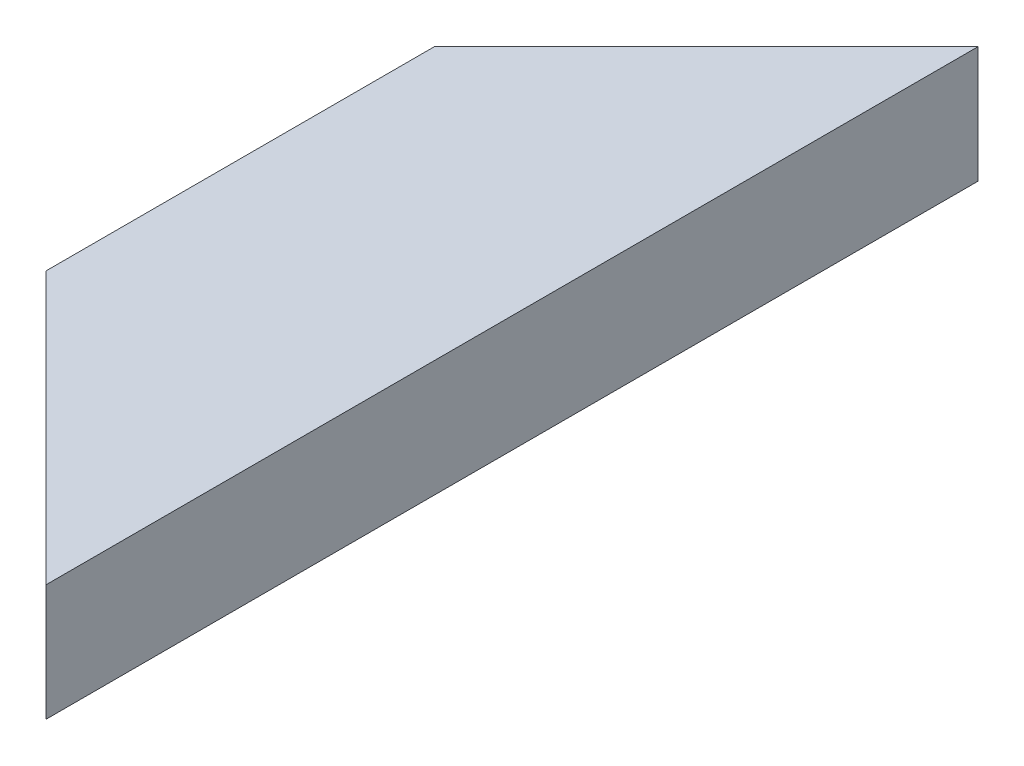
from build123d import *

# Parameters (mm, degrees)
SKETCH1_W           = 88.9
SKETCH1_H           = 38.1
BOSS_EXTRUDE1_DEPTH = 304.8
CUT_EXTRUDE1_DEPTH  = 311.37147501


with BuildPart() as part:
    # Sketch1 → Boss-Extrude1 (new body)
    with BuildSketch(Plane.XY):
        Rectangle(SKETCH1_W, SKETCH1_H)
    extrude(amount=BOSS_EXTRUDE1_DEPTH)

    # Sketch2 → Cut-Extrude1 (cut, through all)
    with BuildSketch(Plane(origin=(0, 19.05, 0), x_dir=(1, 0, 0), z_dir=(0, 1, 0))):
        Polygon((44.45, 0), (-44.45, 0), (-44.45, -88.9), align=None)
        Polygon((-44.45, -304.8), (44.45, -304.8), (-44.45, -215.9), align=None)
    extrude(amount=-CUT_EXTRUDE1_DEPTH, mode=Mode.SUBTRACT)


solid = part.part
